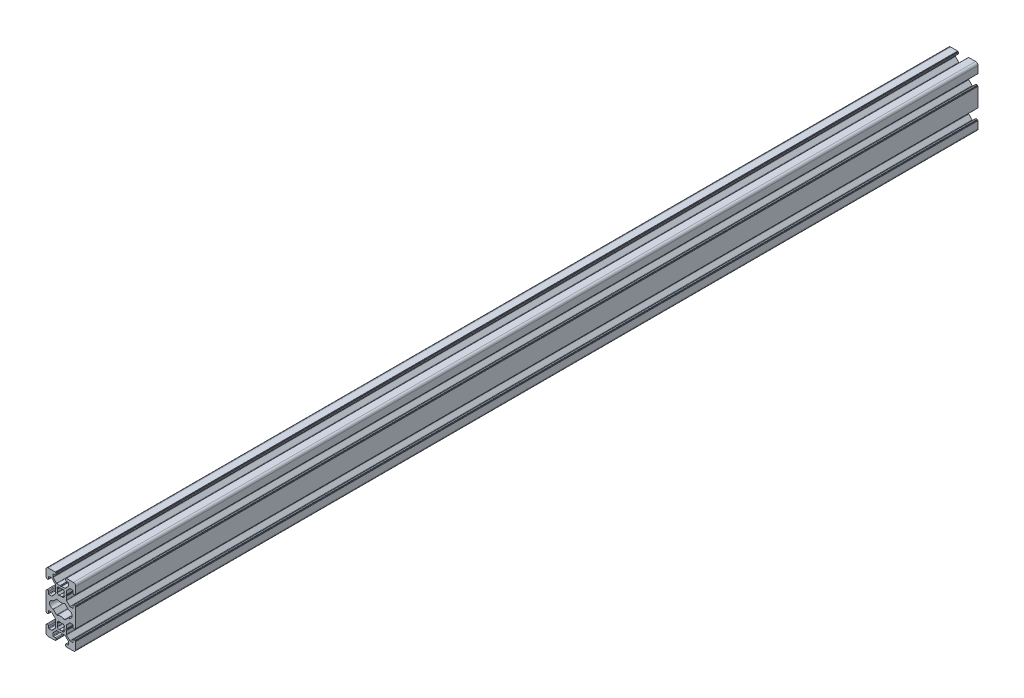
from build123d import *

# Parameters (mm, degrees)
EXTRUDE1_DEPTH = 385.7625


with BuildPart() as part:
    # Sketch1 → Extrude1 (new, symmetric)
    with BuildSketch(Plane.XY):
        with BuildLine():
            Line((-10.6994516, -25.398698189), (-4.749756551, -25.398698189))
            ThreePointArc((-4.749756551, -25.398698189), (-4.608342442, -25.340122547), (-4.549766801, -25.198708439))
            Line((-4.549766801, -25.198708439), (-4.549766801, -25.098713564))
            ThreePointArc((-4.549766801, -25.098713564), (-4.491191159, -24.957299456), (-4.349777051, -24.898723814))
            Line((-4.349777051, -24.898723814), (-4.249782177, -24.898723814))
            ThreePointArc((-4.249782177, -24.898723814), (-4.108368069, -24.840148173), (-4.049792428, -24.698734065))
            Line((-4.049792428, -24.698734065), (-4.049792428, -23.798780192))
            ThreePointArc((-4.049792428, -23.798780192), (-4.225519352, -23.374537868), (-4.649761676, -23.198810944))
            Line((-4.649761676, -23.198810944), (-6.249679673, -23.198810944))
            ThreePointArc((-6.249679673, -23.198810944), (-6.603214943, -23.05237184), (-6.749654046, -22.69883657))
            Line((-6.749654046, -22.69883657), (-6.749654046, -20.716705117))
            ThreePointArc((-6.749654046, -20.716705117), (-6.711595763, -20.525373207), (-6.603214943, -20.363169847))
            Line((-6.603214943, -20.363169847), (-3.785592408, -17.545547312))
            ThreePointArc((-3.785592408, -17.545547312), (-3.623389047, -17.437166491), (-3.432057137, -17.399108208))
            Line((-3.432057137, -17.399108208), (-0.626762794, -17.399108208))
            ThreePointArc((-0.626762794, -17.399108208), (-0.575001639, -17.392293722), (-0.52676792, -17.372314662))
            Line((-0.52676792, -17.372314662), (-0.099994875, -17.125917129))
            ThreePointArc((-0.099994875, -17.125917129), (0, -17.099123583), (0.099994874, -17.125917129))
            Line((0.099994874, -17.125917129), (0.526767919, -17.372314662))
            ThreePointArc((0.526767919, -17.372314662), (0.575001638, -17.392293722), (0.626762793, -17.399108208))
            Line((0.626762793, -17.399108208), (3.432057136, -17.399108208))
            ThreePointArc((3.432057136, -17.399108208), (3.623389046, -17.437166491), (3.785592407, -17.545547312))
            Line((3.785592407, -17.545547312), (6.603214942, -20.363169847))
            ThreePointArc((6.603214942, -20.363169847), (6.711595762, -20.525373207), (6.749654045, -20.716705117))
            Line((6.749654045, -20.716705117), (6.749654045, -22.69883657))
            ThreePointArc((6.749654045, -22.69883657), (6.603214942, -23.05237184), (6.249679672, -23.198810944))
            Line((6.249679672, -23.198810944), (4.649761677, -23.198810944))
            ThreePointArc((4.649761677, -23.198810944), (4.225519353, -23.374537868), (4.049792428, -23.798780192))
            Line((4.049792428, -23.798780192), (4.049792428, -24.698734065))
            ThreePointArc((4.049792428, -24.698734065), (4.10836807, -24.840148173), (4.249782177, -24.898723814))
            Line((4.249782177, -24.898723814), (4.349777052, -24.898723814))
            ThreePointArc((4.349777052, -24.898723814), (4.49119116, -24.957299455), (4.549766802, -25.098713564))
            Line((4.549766802, -25.098713564), (4.549766802, -25.198708439))
            ThreePointArc((4.549766802, -25.198708439), (4.608342443, -25.340122547), (4.749756552, -25.398698188))
            Line((4.749756552, -25.398698188), (10.699451599, -25.398698188))
            ThreePointArc((10.699451599, -25.398698188), (12.11359268, -24.812941774), (12.699349094, -23.398800693))
            Line((12.699349094, -23.398800693), (12.699349094, -17.449105645))
            ThreePointArc((12.699349094, -17.449105645), (12.640773453, -17.307691536), (12.499359344, -17.249115895))
            Line((12.499359344, -17.249115895), (12.399364469, -17.249115895))
            ThreePointArc((12.399364469, -17.249115895), (12.257950361, -17.190540253), (12.199374719, -17.049126145))
            Line((12.199374719, -17.049126145), (12.199374719, -16.949131271))
            ThreePointArc((12.199374719, -16.949131271), (12.140799078, -16.807717163), (11.99938497, -16.749141522))
            Line((11.99938497, -16.749141522), (11.099431097, -16.749141522))
            ThreePointArc((11.099431097, -16.749141522), (10.675188773, -16.924868446), (10.499461849, -17.34911077))
            Line((10.499461849, -17.34911077), (10.499461849, -18.949028767))
            ThreePointArc((10.499461849, -18.949028767), (10.353022745, -19.302564037), (9.999487475, -19.44900314))
            Line((9.999487475, -19.44900314), (8.017356022, -19.44900314))
            ThreePointArc((8.017356022, -19.44900314), (7.826024112, -19.410944857), (7.663820752, -19.302564037))
            Line((7.663820752, -19.302564037), (4.846198217, -16.484941501))
            ThreePointArc((4.846198217, -16.484941501), (4.737817396, -16.32273814), (4.699759113, -16.131406231))
            Line((4.699759113, -16.131406231), (4.699759113, -13.326111888))
            ThreePointArc((4.699759113, -13.326111888), (4.692944627, -13.274350733), (4.672965567, -13.226117014))
            Line((4.672965567, -13.226117014), (4.426568034, -12.799343969))
            ThreePointArc((4.426568034, -12.799343969), (4.399774489, -12.699349094), (4.426568034, -12.59935422))
            Line((4.426568034, -12.59935422), (4.672965567, -12.172581175))
            ThreePointArc((4.672965567, -12.172581175), (4.692944627, -12.124347456), (4.699759113, -12.0725863))
            Line((4.699759113, -12.0725863), (4.699759113, -9.267291958))
            ThreePointArc((4.699759113, -9.267291958), (4.737817396, -9.075960048), (4.846198217, -8.913756687))
            Line((4.846198217, -8.913756687), (7.663820752, -6.096134152))
            ThreePointArc((7.663820752, -6.096134152), (7.826024112, -5.987753332), (8.017356022, -5.949695048))
            Line((8.017356022, -5.949695048), (9.999487475, -5.949695048))
            ThreePointArc((9.999487475, -5.949695048), (10.353022745, -6.096134152), (10.499461849, -6.449669422))
            Line((10.499461849, -6.449669422), (10.499461849, -8.049587417))
            ThreePointArc((10.499461849, -8.049587417), (10.675188773, -8.473829741), (11.099431097, -8.649556666))
            Line((11.099431097, -8.649556666), (11.99938497, -8.649556666))
            ThreePointArc((11.99938497, -8.649556666), (12.140799078, -8.590981024), (12.199374719, -8.449566917))
            Line((12.199374719, -8.449566917), (12.199374719, -8.349572042))
            ThreePointArc((12.199374719, -8.349572042), (12.25795036, -8.208157934), (12.399364469, -8.149582292))
            Line((12.399364469, -8.149582292), (12.499359344, -8.149582292))
            ThreePointArc((12.499359344, -8.149582292), (12.640773452, -8.091006651), (12.699349094, -7.949592542))
            Line((12.699349094, -7.949592542), (12.699349094, 7.949592543))
            ThreePointArc((12.699349094, 7.949592543), (12.640773452, 8.091006651), (12.499359344, 8.149582293))
            Line((12.499359344, 8.149582293), (12.399364469, 8.149582293))
            ThreePointArc((12.399364469, 8.149582293), (12.257950361, 8.208157934), (12.199374719, 8.349572042))
            Line((12.199374719, 8.349572042), (12.199374719, 8.449566917))
            ThreePointArc((12.199374719, 8.449566917), (12.140799078, 8.590981025), (11.99938497, 8.649556666))
            Line((11.99938497, 8.649556666), (11.099431097, 8.649556666))
            ThreePointArc((11.099431097, 8.649556666), (10.675188773, 8.473829742), (10.499461849, 8.049587418))
            Line((10.499461849, 8.049587418), (10.499461849, 6.449669421))
            ThreePointArc((10.499461849, 6.449669421), (10.353022745, 6.096134151), (9.999487475, 5.949695048))
            Line((9.999487475, 5.949695048), (8.017356022, 5.949695048))
            ThreePointArc((8.017356022, 5.949695048), (7.826024112, 5.987753331), (7.663820752, 6.096134151))
            Line((7.663820752, 6.096134151), (4.846198217, 8.913756687))
            ThreePointArc((4.846198217, 8.913756687), (4.737817396, 9.075960047), (4.699759113, 9.267291957))
            Line((4.699759113, 9.267291957), (4.699759113, 12.072586299))
            ThreePointArc((4.699759113, 12.072586299), (4.692944627, 12.124347455), (4.672965567, 12.172581174))
            Line((4.672965567, 12.172581174), (4.426568035, 12.599354219))
            ThreePointArc((4.426568035, 12.599354219), (4.399774489, 12.699349093), (4.426568035, 12.799343968))
            Line((4.426568035, 12.799343968), (4.672965568, 13.226117014))
            ThreePointArc((4.672965568, 13.226117014), (4.692944628, 13.274350732), (4.699759113, 13.326111888))
            Line((4.699759113, 13.326111888), (4.699759113, 16.131406231))
            ThreePointArc((4.699759113, 16.131406231), (4.737817396, 16.32273814), (4.846198217, 16.484941501))
            Line((4.846198217, 16.484941501), (7.663820752, 19.302564036))
            ThreePointArc((7.663820752, 19.302564036), (7.826024113, 19.410944856), (8.017356022, 19.44900314))
            Line((8.017356022, 19.44900314), (9.999487476, 19.44900314))
            ThreePointArc((9.999487476, 19.44900314), (10.353022746, 19.302564036), (10.49946185, 18.949028766))
            Line((10.49946185, 18.949028766), (10.49946185, 17.349110769))
            ThreePointArc((10.49946185, 17.349110769), (10.675188774, 16.924868445), (11.099431098, 16.749141521))
            Line((11.099431098, 16.749141521), (11.999384972, 16.749141521))
            ThreePointArc((11.999384972, 16.749141521), (12.140799079, 16.807717162), (12.199374721, 16.94913127))
            Line((12.199374721, 16.94913127), (12.199374721, 17.049126145))
            ThreePointArc((12.199374721, 17.049126145), (12.257950362, 17.190540253), (12.39936447, 17.249115894))
            Line((12.39936447, 17.249115894), (12.499359346, 17.249115894))
            ThreePointArc((12.499359346, 17.249115894), (12.640773454, 17.307691536), (12.699349096, 17.449105644))
            Line((12.699349096, 17.449105644), (12.699349096, 23.398800691))
            ThreePointArc((12.699349096, 23.398800691), (12.113592681, 24.812941772), (10.699451601, 25.398698186))
            Line((10.699451601, 25.398698186), (4.749756554, 25.398698186))
            ThreePointArc((4.749756554, 25.398698186), (4.608342445, 25.340122545), (4.549766804, 25.198708437))
            Line((4.549766804, 25.198708437), (4.549766804, 25.098713563))
            ThreePointArc((4.549766804, 25.098713563), (4.491191162, 24.957299455), (4.349777054, 24.898723813))
            Line((4.349777054, 24.898723813), (4.249782179, 24.898723813))
            ThreePointArc((4.249782179, 24.898723813), (4.108368071, 24.840148172), (4.04979243, 24.698734064))
            Line((4.04979243, 24.698734064), (4.04979243, 23.798780191))
            ThreePointArc((4.04979243, 23.798780191), (4.225519354, 23.374537867), (4.649761678, 23.198810942))
            Line((4.649761678, 23.198810942), (6.249679673, 23.198810942))
            ThreePointArc((6.249679673, 23.198810942), (6.603214943, 23.052371839), (6.749654047, 22.698836569))
            Line((6.749654047, 22.698836569), (6.749654047, 20.716705116))
            ThreePointArc((6.749654047, 20.716705116), (6.711595764, 20.525373207), (6.603214943, 20.363169846))
            Line((6.603214943, 20.363169846), (3.785592407, 17.545547311))
            ThreePointArc((3.785592407, 17.545547311), (3.623389046, 17.43716649), (3.432057137, 17.399108207))
            Line((3.432057137, 17.399108207), (0.626762794, 17.399108207))
            ThreePointArc((0.626762794, 17.399108207), (0.575001638, 17.392293721), (0.52676792, 17.372314661))
            Line((0.52676792, 17.372314661), (0.099994875, 17.125917129))
            ThreePointArc((0.099994875, 17.125917129), (0, 17.099123583), (-0.099994875, 17.125917129))
            Line((-0.099994875, 17.125917129), (-0.52676792, 17.372314661))
            ThreePointArc((-0.52676792, 17.372314661), (-0.575001638, 17.392293721), (-0.626762794, 17.399108207))
            Line((-0.626762794, 17.399108207), (-3.432057137, 17.399108207))
            ThreePointArc((-3.432057137, 17.399108207), (-3.623389046, 17.43716649), (-3.785592407, 17.545547311))
            Line((-3.785592407, 17.545547311), (-6.603214943, 20.363169846))
            ThreePointArc((-6.603214943, 20.363169846), (-6.711595763, 20.525373207), (-6.749654046, 20.716705116))
            Line((-6.749654046, 20.716705116), (-6.749654046, 22.698836569))
            ThreePointArc((-6.749654046, 22.698836569), (-6.603214943, 23.052371839), (-6.249679673, 23.198810942))
            Line((-6.249679673, 23.198810942), (-4.649761677, 23.198810942))
            ThreePointArc((-4.649761677, 23.198810942), (-4.225519352, 23.374537867), (-4.049792428, 23.798780191))
            Line((-4.049792428, 23.798780191), (-4.049792428, 24.698734064))
            ThreePointArc((-4.049792428, 24.698734064), (-4.10836807, 24.840148172), (-4.249782178, 24.898723814))
            Line((-4.249782178, 24.898723814), (-4.349777052, 24.898723814))
            ThreePointArc((-4.349777052, 24.898723814), (-4.49119116, 24.957299455), (-4.549766802, 25.098713564))
            Line((-4.549766802, 25.098713564), (-4.549766802, 25.198708437))
            ThreePointArc((-4.549766802, 25.198708437), (-4.608342443, 25.340122546), (-4.749756551, 25.398698187))
            Line((-4.749756551, 25.398698187), (-10.6994516, 25.398698187))
            ThreePointArc((-10.6994516, 25.398698187), (-12.113592681, 24.812941772), (-12.699349095, 23.398800692))
            Line((-12.699349095, 23.398800692), (-12.699349095, 17.449105643))
            ThreePointArc((-12.699349095, 17.449105643), (-12.640773454, 17.307691535), (-12.499359345, 17.249115893))
            Line((-12.499359345, 17.249115893), (-12.39936447, 17.249115893))
            ThreePointArc((-12.39936447, 17.249115893), (-12.257950363, 17.190540252), (-12.199374721, 17.049126144))
            Line((-12.199374721, 17.049126144), (-12.199374721, 16.949131269))
            ThreePointArc((-12.199374721, 16.949131269), (-12.14079908, 16.807717161), (-11.999384972, 16.74914152))
            Line((-11.999384972, 16.74914152), (-11.099431099, 16.74914152))
            ThreePointArc((-11.099431099, 16.74914152), (-10.675188775, 16.924868444), (-10.49946185, 17.349110768))
            Line((-10.49946185, 17.349110768), (-10.49946185, 18.949028765))
            ThreePointArc((-10.49946185, 18.949028765), (-10.353022747, 19.302564035), (-9.999487476, 19.449003139))
            Line((-9.999487476, 19.449003139), (-8.017356023, 19.449003139))
            ThreePointArc((-8.017356023, 19.449003139), (-7.826024113, 19.410944856), (-7.663820752, 19.302564035))
            Line((-7.663820752, 19.302564035), (-4.846198218, 16.4849415))
            ThreePointArc((-4.846198218, 16.4849415), (-4.737817397, 16.32273814), (-4.699759114, 16.13140623))
            Line((-4.699759114, 16.13140623), (-4.699759114, 13.326111888))
            ThreePointArc((-4.699759114, 13.326111888), (-4.692944628, 13.274350732), (-4.672965568, 13.226117013))
            Line((-4.672965568, 13.226117013), (-4.426568035, 12.799343967))
            ThreePointArc((-4.426568035, 12.799343967), (-4.399774489, 12.699349093), (-4.426568035, 12.599354218))
            Line((-4.426568035, 12.599354218), (-4.672965567, 12.172581173))
            ThreePointArc((-4.672965567, 12.172581173), (-4.692944628, 12.124347455), (-4.699759113, 12.072586299))
            Line((-4.699759113, 12.072586299), (-4.699759113, 9.267291956))
            ThreePointArc((-4.699759113, 9.267291956), (-4.737817396, 9.075960047), (-4.846198217, 8.913756686))
            Line((-4.846198217, 8.913756686), (-7.663820752, 6.096134151))
            ThreePointArc((-7.663820752, 6.096134151), (-7.826024113, 5.98775333), (-8.017356022, 5.949695047))
            Line((-8.017356022, 5.949695047), (-9.999487476, 5.949695047))
            ThreePointArc((-9.999487476, 5.949695047), (-10.353022745, 6.096134151), (-10.499461849, 6.449669421))
            Line((-10.499461849, 6.449669421), (-10.499461849, 8.049587417))
            ThreePointArc((-10.499461849, 8.049587417), (-10.675188773, 8.473829741), (-11.099431097, 8.649556665))
            Line((-11.099431097, 8.649556665), (-11.999384971, 8.649556665))
            ThreePointArc((-11.999384971, 8.649556665), (-12.140799078, 8.590981024), (-12.19937472, 8.449566916))
            Line((-12.19937472, 8.449566916), (-12.19937472, 8.349572041))
            ThreePointArc((-12.19937472, 8.349572041), (-12.257950361, 8.208157933), (-12.399364469, 8.149582292))
            Line((-12.399364469, 8.149582292), (-12.499359344, 8.149582292))
            ThreePointArc((-12.499359344, 8.149582292), (-12.640773452, 8.09100665), (-12.699349094, 7.949592542))
            Line((-12.699349094, 7.949592542), (-12.699349094, -7.949592543))
            ThreePointArc((-12.699349094, -7.949592543), (-12.640773452, -8.091006651), (-12.499359344, -8.149582293))
            Line((-12.499359344, -8.149582293), (-12.399364469, -8.149582293))
            ThreePointArc((-12.399364469, -8.149582293), (-12.257950361, -8.208157934), (-12.199374719, -8.349572043))
            Line((-12.199374719, -8.349572043), (-12.199374719, -8.449566918))
            ThreePointArc((-12.199374719, -8.449566918), (-12.140799078, -8.590981025), (-11.999384971, -8.649556666))
            Line((-11.999384971, -8.649556666), (-11.099431097, -8.649556666))
            ThreePointArc((-11.099431097, -8.649556666), (-10.675188773, -8.473829742), (-10.499461849, -8.049587418))
            Line((-10.499461849, -8.049587418), (-10.499461849, -6.449669423))
            ThreePointArc((-10.499461849, -6.449669423), (-10.353022745, -6.096134153), (-9.999487476, -5.949695049))
            Line((-9.999487476, -5.949695049), (-8.017356022, -5.949695049))
            ThreePointArc((-8.017356022, -5.949695049), (-7.826024113, -5.987753332), (-7.663820752, -6.096134153))
            Line((-7.663820752, -6.096134153), (-4.846198217, -8.913756688))
            ThreePointArc((-4.846198217, -8.913756688), (-4.737817396, -9.075960049), (-4.699759113, -9.267291959))
            Line((-4.699759113, -9.267291959), (-4.699759113, -12.072586301))
            ThreePointArc((-4.699759113, -12.072586301), (-4.692944628, -12.124347457), (-4.672965567, -12.172581175))
            Line((-4.672965567, -12.172581175), (-4.426568035, -12.59935422))
            ThreePointArc((-4.426568035, -12.59935422), (-4.399774489, -12.699349095), (-4.426568035, -12.79934397))
            Line((-4.426568035, -12.79934397), (-4.672965567, -13.226117015))
            ThreePointArc((-4.672965567, -13.226117015), (-4.692944628, -13.274350733), (-4.699759113, -13.326111889))
            Line((-4.699759113, -13.326111889), (-4.699759113, -16.131406231))
            ThreePointArc((-4.699759113, -16.131406231), (-4.737817396, -16.322738141), (-4.846198217, -16.484941502))
            Line((-4.846198217, -16.484941502), (-7.663820752, -19.302564037))
            ThreePointArc((-7.663820752, -19.302564037), (-7.826024113, -19.410944858), (-8.017356022, -19.449003141))
            Line((-8.017356022, -19.449003141), (-9.999487476, -19.449003141))
            ThreePointArc((-9.999487476, -19.449003141), (-10.353022745, -19.302564037), (-10.499461849, -18.949028767))
            Line((-10.499461849, -18.949028767), (-10.499461849, -17.349110771))
            ThreePointArc((-10.499461849, -17.349110771), (-10.675188773, -16.924868447), (-11.099431097, -16.749141523))
            Line((-11.099431097, -16.749141523), (-11.999384971, -16.749141523))
            ThreePointArc((-11.999384971, -16.749141523), (-12.140799078, -16.807717164), (-12.19937472, -16.949131272))
            Line((-12.19937472, -16.949131272), (-12.19937472, -17.049126146))
            ThreePointArc((-12.19937472, -17.049126146), (-12.257950361, -17.190540254), (-12.39936447, -17.249115895))
            Line((-12.39936447, -17.249115895), (-12.499359345, -17.249115895))
            ThreePointArc((-12.499359345, -17.249115895), (-12.640773453, -17.307691537), (-12.699349095, -17.449105645))
            Line((-12.699349095, -17.449105645), (-12.699349095, -23.398800694))
            ThreePointArc((-12.699349095, -23.398800694), (-12.11359268, -24.812941774), (-10.6994516, -25.398698189))
        make_face()
        with BuildLine():
            Line((-2.771771075, 11.406851015), (-2.978278663, 11.310554946))
            ThreePointArc((-2.978278663, 11.310554946), (-3.13776956, 11.128344443), (-3.110726926, 10.887706313))
            ThreePointArc((-3.110726926, 10.887706313), (-2.545453946, 10.153895149), (-1.811642782, 9.588622168))
            ThreePointArc((-1.811642782, 9.588622168), (-1.571004652, 9.561579534), (-1.388794149, 9.721070431))
            Line((-1.388794149, 9.721070431), (-1.292498078, 9.92757802))
            ThreePointArc((-1.292498078, 9.92757802), (-1.185744598, 10.02865458), (-1.03873385, 10.029439802))
            ThreePointArc((-1.03873385, 10.029439802), (0, 9.834495932), (1.03873385, 10.029439802))
            ThreePointArc((1.03873385, 10.029439802), (1.185744597, 10.02865458), (1.292498078, 9.92757802))
            Line((1.292498078, 9.92757802), (1.388794148, 9.721070431))
            ThreePointArc((1.388794148, 9.721070431), (1.571004651, 9.561579534), (1.811642782, 9.588622168))
            ThreePointArc((1.811642782, 9.588622168), (2.545453946, 10.153895148), (3.110726926, 10.887706313))
            ThreePointArc((3.110726926, 10.887706313), (3.13776956, 11.128344443), (2.978278663, 11.310554946))
            Line((2.978278663, 11.310554946), (2.771771074, 11.406851016))
            ThreePointArc((2.771771074, 11.406851016), (2.670694514, 11.513604497), (2.669909292, 11.660615245))
            ThreePointArc((2.669909292, 11.660615245), (2.864853161, 12.699349094), (2.669909292, 13.738082943))
            ThreePointArc((2.669909292, 13.738082943), (2.670694514, 13.885093691), (2.771771074, 13.991847172))
            Line((2.771771074, 13.991847172), (2.978278662, 14.088143242))
            ThreePointArc((2.978278662, 14.088143242), (3.13776956, 14.270353745), (3.110726926, 14.510991875))
            ThreePointArc((3.110726926, 14.510991875), (2.545453945, 15.244803039), (1.811642782, 15.810076019))
            ThreePointArc((1.811642782, 15.810076019), (1.571004651, 15.837118653), (1.388794148, 15.677627756))
            Line((1.388794148, 15.677627756), (1.292498078, 15.471120167))
            ThreePointArc((1.292498078, 15.471120167), (1.185744597, 15.370043607), (1.03873385, 15.369258385))
            ThreePointArc((1.03873385, 15.369258385), (0, 15.564202255), (-1.038733849, 15.369258385))
            ThreePointArc((-1.038733849, 15.369258385), (-1.185744597, 15.370043607), (-1.292498078, 15.471120167))
            Line((-1.292498078, 15.471120167), (-1.388794148, 15.677627755))
            ThreePointArc((-1.388794148, 15.677627755), (-1.571004651, 15.837118653), (-1.811642782, 15.810076019))
            ThreePointArc((-1.811642782, 15.810076019), (-2.545453945, 15.244803038), (-3.110726926, 14.510991875))
            ThreePointArc((-3.110726926, 14.510991875), (-3.137769559, 14.270353745), (-2.978278662, 14.088143242))
            Line((-2.978278662, 14.088143242), (-2.771771074, 13.991847172))
            ThreePointArc((-2.771771074, 13.991847172), (-2.670694514, 13.885093691), (-2.669909292, 13.738082943))
            ThreePointArc((-2.669909292, 13.738082943), (-2.864853162, 12.699349094), (-2.669909292, 11.660615245))
            ThreePointArc((-2.669909292, 11.660615245), (-2.670694515, 11.513604496), (-2.771771075, 11.406851015))
        make_face(mode=Mode.SUBTRACT)
        with BuildLine():
            Line((-2.97827866, -11.310554948), (-2.771771073, -11.406851017))
            ThreePointArc((-2.771771073, -11.406851017), (-2.670694513, -11.513604498), (-2.669909291, -11.660615246))
            ThreePointArc((-2.669909291, -11.660615246), (-2.86485316, -12.699349095), (-2.669909291, -13.738082945))
            ThreePointArc((-2.669909291, -13.738082945), (-2.670694513, -13.885093694), (-2.771771074, -13.991847175))
            Line((-2.771771074, -13.991847175), (-2.97827866, -14.088143242))
            ThreePointArc((-2.97827866, -14.088143242), (-3.137769559, -14.270353746), (-3.110726925, -14.510991877))
            ThreePointArc((-3.110726925, -14.510991877), (-2.545453945, -15.24480304), (-1.811642781, -15.810076021))
            ThreePointArc((-1.811642781, -15.810076021), (-1.571004651, -15.837118655), (-1.388794148, -15.677627757))
            Line((-1.388794148, -15.677627757), (-1.292498078, -15.471120169))
            ThreePointArc((-1.292498078, -15.471120169), (-1.185744597, -15.37004361), (-1.03873385, -15.369258387))
            ThreePointArc((-1.03873385, -15.369258387), (0, -15.564202257), (1.03873385, -15.369258387))
            ThreePointArc((1.03873385, -15.369258387), (1.185744598, -15.37004361), (1.292498079, -15.471120169))
            Line((1.292498079, -15.471120169), (1.388794149, -15.677627757))
            ThreePointArc((1.388794149, -15.677627757), (1.571004652, -15.837118655), (1.811642782, -15.810076021))
            ThreePointArc((1.811642782, -15.810076021), (2.545453946, -15.244803041), (3.110726926, -14.510991877))
            ThreePointArc((3.110726926, -14.510991877), (3.13776956, -14.270353746), (2.978278661, -14.088143243))
            Line((2.978278661, -14.088143243), (2.771771075, -13.991847176))
            ThreePointArc((2.771771075, -13.991847176), (2.670694514, -13.885093694), (2.669909292, -13.738082946))
            ThreePointArc((2.669909292, -13.738082946), (2.864853162, -12.699349096), (2.669909292, -11.660615247))
            ThreePointArc((2.669909292, -11.660615247), (2.670694515, -11.513604499), (2.771771075, -11.406851018))
            Line((2.771771075, -11.406851018), (2.978278663, -11.310554948))
            ThreePointArc((2.978278663, -11.310554948), (3.13776956, -11.128344445), (3.110726926, -10.887706315))
            ThreePointArc((3.110726926, -10.887706315), (2.545453946, -10.153895151), (1.811642782, -9.58862217))
            ThreePointArc((1.811642782, -9.58862217), (1.571004652, -9.561579536), (1.388794149, -9.721070434))
            Line((1.388794149, -9.721070434), (1.292498078, -9.927578024))
            ThreePointArc((1.292498078, -9.927578024), (1.185744597, -10.028654583), (1.038733849, -10.029439806))
            ThreePointArc((1.038733849, -10.029439806), (1e-09, -9.834495936), (-1.038733848, -10.029439805))
            ThreePointArc((-1.038733848, -10.029439805), (-1.185744596, -10.028654583), (-1.292498077, -9.927578023))
            Line((-1.292498077, -9.927578023), (-1.388794146, -9.721070435))
            ThreePointArc((-1.388794146, -9.721070435), (-1.57100465, -9.561579538), (-1.81164278, -9.588622172))
            ThreePointArc((-1.81164278, -9.588622172), (-2.545453943, -10.153895152), (-3.110726924, -10.887706315))
            ThreePointArc((-3.110726924, -10.887706315), (-3.137769557, -11.128344445), (-2.97827866, -11.310554948))
        make_face(mode=Mode.SUBTRACT)
        with BuildLine():
            Line((-3.720951365, 5.796580297), (-6.371337156, 3.146194505))
            ThreePointArc((-6.371337156, 3.146194505), (-6.531877721, 3.038505949), (-6.721270166, 2.999768379))
            ThreePointArc((-6.721270166, 2.999768379), (-9.699502851, -1e-09), (-6.721270166, -2.999768381))
            ThreePointArc((-6.721270166, -2.999768381), (-6.53187772, -3.038505952), (-6.371337156, -3.146194508))
            Line((-6.371337156, -3.146194508), (-3.720951364, -5.796580299))
            ThreePointArc((-3.720951364, -5.796580299), (-3.454689052, -5.935343521), (-3.156952589, -5.896564033))
            ThreePointArc((-3.156952589, -5.896564033), (0, -5.199733489), (3.156952589, -5.896564033))
            ThreePointArc((3.156952589, -5.896564033), (3.454689053, -5.935343521), (3.720951365, -5.796580299))
            Line((3.720951365, -5.796580299), (6.371337157, -3.146194508))
            ThreePointArc((6.371337157, -3.146194508), (6.531877721, -3.038505952), (6.721270167, -2.999768381))
            ThreePointArc((6.721270167, -2.999768381), (9.699502852, 0), (6.721270166, 2.99976838))
            ThreePointArc((6.721270166, 2.99976838), (6.53187772, 3.03850595), (6.371337156, 3.146194506))
            Line((6.371337156, 3.146194506), (3.720951365, 5.796580297))
            ThreePointArc((3.720951365, 5.796580297), (3.454689053, 5.935343519), (3.156952589, 5.896564031))
            ThreePointArc((3.156952589, 5.896564031), (0, 5.199733486), (-3.156952588, 5.896564031))
            ThreePointArc((-3.156952588, 5.896564031), (-3.454689053, 5.935343519), (-3.720951365, 5.796580297))
        make_face(mode=Mode.SUBTRACT)
    extrude(amount=EXTRUDE1_DEPTH, both=True)


solid = part.part
